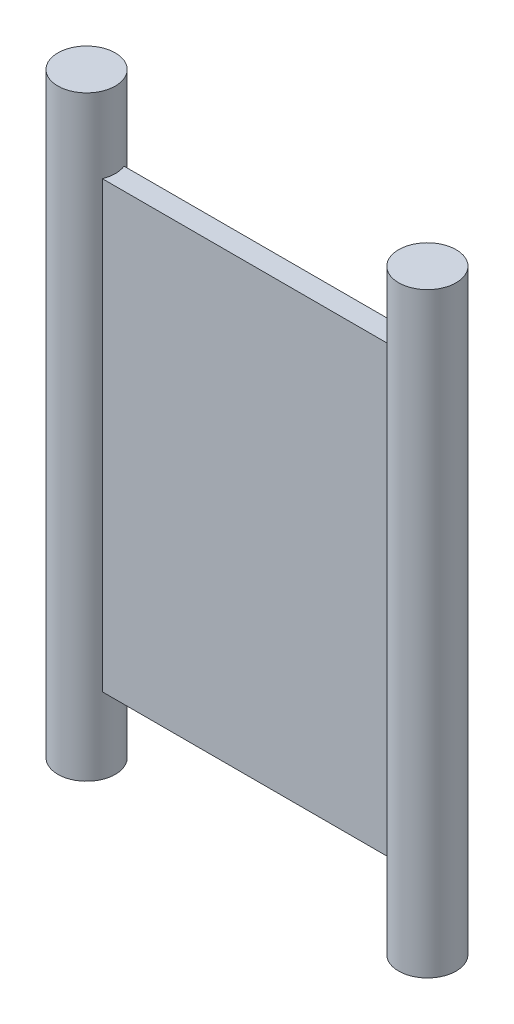
from build123d import *

# Parameters (mm, degrees)
SKETCH1_W           = 15.72
SKETCH1_H           = 1
BOSS_EXTRUDE1_DEPTH = 20.5
SKETCH2_R           = 1.325
BOSS_EXTRUDE2_DEPTH = 13.75


with BuildPart() as part:
    # Sketch1 → Boss-Extrude1 (new body)
    with BuildSketch(Plane(origin=(0, 0, 0), x_dir=(1, 0, 0), z_dir=(0, 1, 0))):
        Rectangle(SKETCH1_W, SKETCH1_H)
    extrude(amount=BOSS_EXTRUDE1_DEPTH)

    # Sketch2 → Boss-Extrude2 (add, symmetric)
    with BuildSketch(Plane(origin=(0, 10.25, 0), x_dir=(1, 0, 0), z_dir=(0, 1, 0))):
        with Locations(Location((-7.86, 0, 0), (0, 0, 270))):
            Circle(SKETCH2_R)
        with Locations(Location((7.86, 0, 0), (0, 0, 270))):
            Circle(SKETCH2_R)
    extrude(amount=BOSS_EXTRUDE2_DEPTH, both=True)


solid = part.part
